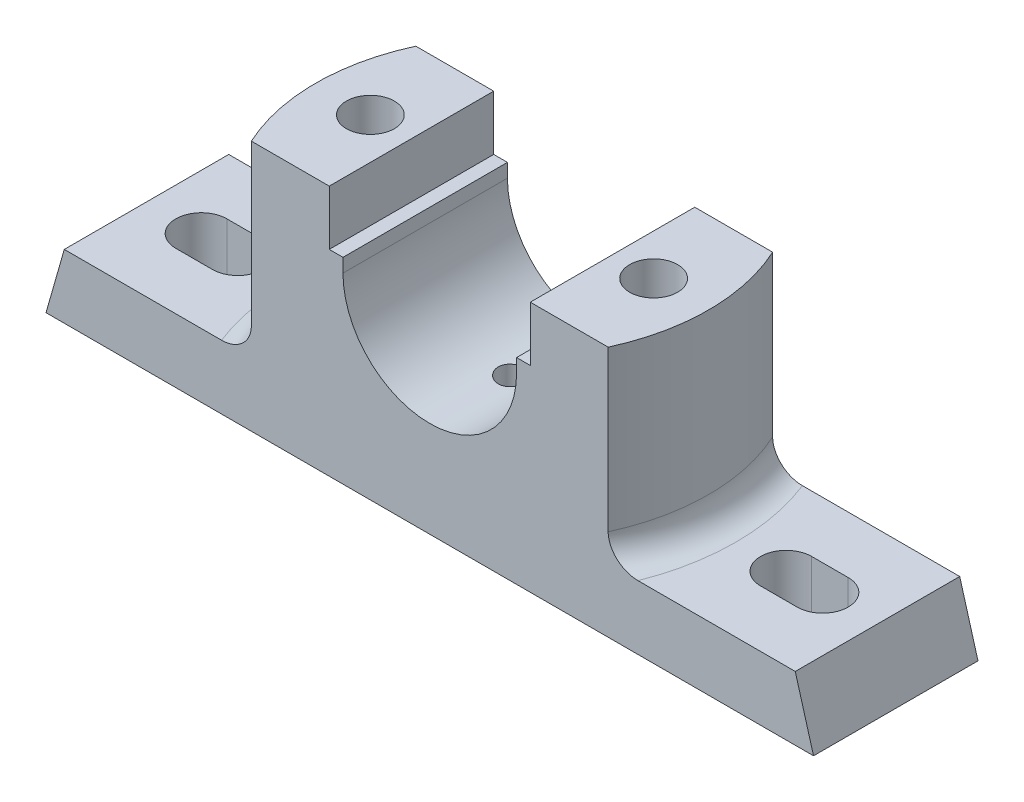
from build123d import *

# Parameters (mm, degrees)
BOSS_EXTRUDE1_DEPTH = 18
BOSS_EXTRUDE2_DEPTH = 41
CUT_EXTRUDE1_DEPTH  = 12
FILLET1_R           = 6
CUT_EXTRUDE2_DEPTH  = 107.663020935
SKETCH7_R           = 5.25
CUT_EXTRUDE3_DEPTH  = 46
SKETCH10_W          = 68
SKETCH10_H          = 20
CUT_EXTRUDE4_DEPTH  = 2
FILLET2_R           = 1
SKETCH11_W          = 20
SKETCH11_H          = 20
CUT_EXTRUDE5_DEPTH  = 9
SKETCH15_R          = 3
CUT_EXTRUDE6_DEPTH  = 10


with BuildPart() as part:
    # Sketch2 → Boss-Extrude1 (new, symmetric)
    with BuildSketch(Plane.XY):
        Polygon((-84, 0), (84, 0), (80, 14), (-80, 14), align=None)
    extrude(amount=BOSS_EXTRUDE1_DEPTH, both=True)

    # Sketch3 → Boss-Extrude2 (add)
    with BuildSketch(Plane(origin=(0, 14, 0), x_dir=(1, 0, 0), z_dir=(0, 1, 0))):
        with BuildLine():
            Line((-39.05124838, 18), (39.05124838, 18))
            ThreePointArc((39.05124838, 18), (43, 0), (39.05124838, -18))
            Line((39.05124838, -18), (-39.05124838, -18))
            ThreePointArc((-39.05124838, -18), (-43, 0), (-39.05124838, 18))
        make_face()
    extrude(amount=BOSS_EXTRUDE2_DEPTH)

    # Sketch4 → Cut-Extrude1 (cut)
    with BuildSketch(Plane(origin=(0, 14, 0), x_dir=(1, 0, 0), z_dir=(0, 1, 0))):
        with BuildLine():
            Line((60, 5.595094271), (68, 5.595094271))
            ThreePointArc((68, 5.595094271), (73.595094271, 0), (68, -5.595094271))
            Line((68, -5.595094271), (60, -5.595094271))
            ThreePointArc((60, -5.595094271), (54.404905729, 0), (60, 5.595094271))
        make_face()
        with BuildLine():
            Line((-60, 5.595094271), (-68, 5.595094271))
            ThreePointArc((-68, 5.595094271), (-73.595094271, 0), (-68, -5.595094271))
            Line((-68, -5.595094271), (-60, -5.595094271))
            ThreePointArc((-60, -5.595094271), (-54.404905729, 0), (-60, 5.595094271))
        make_face()
    extrude(amount=-CUT_EXTRUDE1_DEPTH, mode=Mode.SUBTRACT)

    # Fillet1
    fillet1_edges = [part.edges().sort_by_distance(p)[0] for p in [
        (43, 14, 0),
        (-43, 14, 0),
    ]]
    fillet(fillet1_edges, radius=FILLET1_R)

    # Sketch5 → Cut-Extrude2 (cut, through all)
    with BuildSketch(Plane.XY.offset(18)):
        with BuildLine():
            Line((22, 55), (22, 43))
            Line((22, 43), (19, 43))
            Line((19, 43), (19, 40))
            ThreePointArc((19, 40), (0, 21), (-19, 40))
            Line((-19, 40), (-19, 43))
            Line((-19, 43), (-22, 43))
            Line((-22, 43), (-22, 55))
            Line((-22, 55), (22, 55))
        make_face()
    extrude(amount=-CUT_EXTRUDE2_DEPTH, mode=Mode.SUBTRACT)

    # Sketch7 → Cut-Extrude3 (cut)
    with BuildSketch(Plane(origin=(0, 55, 0), x_dir=(1, 0, 0), z_dir=(0, 1, 0))):
        with Locations(Location((31, 0, 0), (0, 0, 180))):
            Circle(SKETCH7_R)
        with Locations((-31, 0)):
            Circle(SKETCH7_R)
    extrude(amount=-CUT_EXTRUDE3_DEPTH, mode=Mode.SUBTRACT)

    # Sketch10 → Cut-Extrude4 (cut)
    with BuildSketch(Plane.XZ):
        with Locations((42, 0)):
            Rectangle(SKETCH10_W, SKETCH10_H)
        with Locations((-42, 0)):
            Rectangle(SKETCH10_W, SKETCH10_H)
    extrude(amount=-CUT_EXTRUDE4_DEPTH, mode=Mode.SUBTRACT)

    # Fillet2
    fillet2_edges = [part.edges().sort_by_distance(p)[0] for p in [
        (76, 2, 0),
        (8, 2, 0),
        (-8, 2, 0),
        (-76, 2, 0),
    ]]
    fillet(fillet2_edges, radius=FILLET2_R)

    # Sketch11 → Cut-Extrude5 (cut)
    with BuildSketch(Plane.XZ):
        with Locations((31, 0)):
            Rectangle(SKETCH11_W, SKETCH11_H)
        with Locations((-31, 0)):
            Rectangle(SKETCH11_W, SKETCH11_H)
    extrude(amount=-CUT_EXTRUDE5_DEPTH, mode=Mode.SUBTRACT)

    # Sketch15 → Cut-Extrude6 (cut)
    with BuildSketch(Plane(origin=(0, 25, 0), x_dir=(-1, 0, 0), z_dir=(0, -1, 0))):
        Circle(SKETCH15_R)
    extrude(amount=CUT_EXTRUDE6_DEPTH, mode=Mode.SUBTRACT)


solid = part.part
